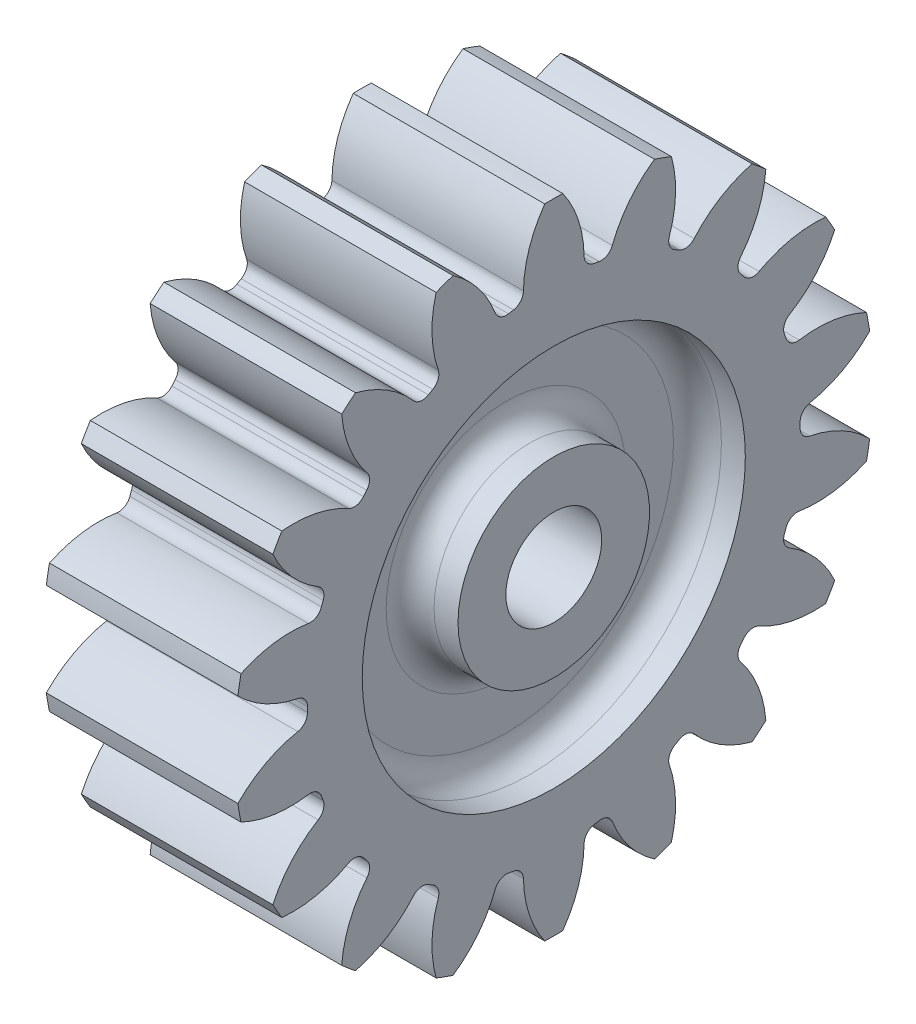
from build123d import *

# Parameters (mm, degrees)
CUT_EXTRUDE1_DEPTH = 3.560815886


with BuildPart() as part:
    # Sketch2 → Revolve1 (revolve)
    with BuildSketch(Plane(origin=(0, 0, 0), x_dir=(1, 0, 0), z_dir=(0, 1, 0)), mode=Mode.PRIVATE) as revolve1_sk:
        with BuildLine():
            Line((-0.5, 0.5), (-0.5, 0.25))
            Line((-0.5, 0.25), (0.5, 0.25))
            Line((0.5, 0.25), (0.5, 0.5))
            Line((0.5, 0.5), (0.375, 0.5))
            ThreePointArc((0.375, 0.5), (0.286611652, 0.536611652), (0.25, 0.625))
            Line((0.25, 0.625), (0.25, 0.875))
            ThreePointArc((0.25, 0.875), (0.286611652, 0.963388348), (0.375, 1))
            Line((0.375, 1), (0.5, 1))
            Line((0.5, 1), (0.5, 1.667))
            Line((0.5, 1.667), (-0.5, 1.667))
            Line((-0.5, 1.667), (-0.5, 1))
            Line((-0.5, 1), (-0.375, 1))
            ThreePointArc((-0.375, 1), (-0.286611652, 0.963388348), (-0.25, 0.875))
            Line((-0.25, 0.875), (-0.25, 0.625))
            ThreePointArc((-0.25, 0.625), (-0.286611652, 0.536611652), (-0.375, 0.5))
            Line((-0.375, 0.5), (-0.5, 0.5))
        make_face()
    revolve(revolve1_sk.sketch.rotate(Axis((-2.928512328, 0, 0), (1, 0, 0)), 180), axis=Axis((-2.928512328, 0, 0), (1, 0, 0)))

    # Sketch3 → Cut-Extrude1 (cut, through all)
    with BuildSketch(Plane(origin=(0.5, 0, 0), x_dir=(0, 0, -1), z_dir=(1, 0, 0))):
        with BuildLine():
            ThreePointArc((-0.132038984, 1.494177268), (-0.096451178, 1.583681212), (-0.047, 1.666337301))
            ThreePointArc((-0.047, 1.666337301), (-0.289471512, 1.641674524), (-0.525755369, 1.581919812))
            ThreePointArc((-0.525755369, 1.581919812), (-0.451016415, 1.521161794), (-0.386962665, 1.449227345))
            ThreePointArc((-0.386962665, 1.449227345), (-0.260472267, 1.47721163), (-0.132038984, 1.494177268))
        make_face()
        with BuildLine():
            ThreePointArc((-0.158403009, 1.328746492), (-0.15102288, 1.412386502), (-0.132038984, 1.494177268))
            ThreePointArc((-0.132038984, 1.494177268), (-0.260472267, 1.47721163), (-0.386962665, 1.449227345))
            ThreePointArc((-0.386962665, 1.449227345), (-0.341149548, 1.378862041), (-0.305607927, 1.302790293))
            ThreePointArc((-0.305607927, 1.302790293), (-0.277975364, 1.270913104), (-0.236343208, 1.26409568))
            ThreePointArc((-0.236343208, 1.26409568), (-0.223311556, 1.26646277), (-0.210256217, 1.26869552))
            ThreePointArc((-0.210256217, 1.26869552), (-0.173466484, 1.289340839), (-0.158403009, 1.328746492))
        make_face()
        with BuildLine():
            ThreePointArc((-0.635114782, 1.35890736), (-0.632285335, 1.455185303), (-0.614086476, 1.549769919))
            ThreePointArc((-0.614086476, 1.549769919), (-0.8335, 1.443664348), (-1.035096882, 1.306699447))
            ThreePointArc((-1.035096882, 1.306699447), (-0.944084772, 1.275167814), (-0.859290905, 1.229479215))
            ThreePointArc((-0.859290905, 1.229479215), (-0.75, 1.299038106), (-0.635114782, 1.35890736))
        make_face()
        with BuildLine():
            ThreePointArc((-0.603308204, 1.194436253), (-0.624979719, 1.275556307), (-0.635114782, 1.35890736))
            ThreePointArc((-0.635114782, 1.35890736), (-0.75, 1.299038106), (-0.859290905, 1.229479215))
            ThreePointArc((-0.859290905, 1.229479215), (-0.792174306, 1.179026467), (-0.732758036, 1.119698358))
            ThreePointArc((-0.732758036, 1.119698358), (-0.69588928, 1.099194492), (-0.654436154, 1.107027245))
            ThreePointArc((-0.654436154, 1.107027245), (-0.643, 1.113708669), (-0.63149564, 1.120271957))
            ThreePointArc((-0.63149564, 1.120271957), (-0.603985713, 1.152255041), (-0.603308204, 1.194436253))
        make_face()
        with BuildLine():
            ThreePointArc((-1.061586364, 1.05973317), (-1.09185655, 1.15117257), (-1.107105059, 1.246277412))
            ThreePointArc((-1.107105059, 1.246277412), (-1.276996087, 1.071526945), (-1.419590434, 0.873871844))
            ThreePointArc((-1.419590434, 0.873871844), (-1.323282572, 0.875369776), (-1.22797598, 0.861437748))
            ThreePointArc((-1.22797598, 0.861437748), (-1.149066665, 0.964181415), (-1.061586364, 1.05973317))
        make_face()
        with BuildLine():
            ThreePointArc((-0.975445526, 0.916059375), (-1.023554781, 0.984875196), (-1.061586364, 1.05973317))
            ThreePointArc((-1.061586364, 1.05973317), (-1.149066665, 0.964181415), (-1.22797598, 0.861437748))
            ThreePointArc((-1.22797598, 0.861437748), (-1.147651151, 0.836982901), (-1.071526712, 0.801554276))
            ThreePointArc((-1.071526712, 0.801554276), (-1.029868679, 0.794896801), (-0.993594441, 0.816434986))
            ThreePointArc((-0.993594441, 0.816434986), (-0.985133154, 0.826624866), (-0.976567368, 0.836727062))
            ThreePointArc((-0.976567368, 0.836727062), (-0.961655352, 0.876190279), (-0.975445526, 0.916059375))
        make_face()
        with BuildLine():
            ThreePointArc((-1.360014963, 0.63273952), (-1.41973375, 0.708311436), (-1.466590434, 0.792465456))
            ThreePointArc((-1.466590434, 0.792465456), (-1.566467599, 0.570147579), (-1.632860429, 0.3356424))
            ThreePointArc((-1.632860429, 0.3356424), (-1.542872965, 0.369989224), (-1.448549029, 0.389494174))
            ThreePointArc((-1.448549029, 0.389494174), (-1.409538931, 0.513030215), (-1.360014963, 0.63273952))
        make_face()
        with BuildLine():
            ThreePointArc((-1.229929722, 0.527192216), (-1.298674031, 0.575403601), (-1.360014963, 0.63273952))
            ThreePointArc((-1.360014963, 0.63273952), (-1.409538931, 0.513030215), (-1.448549029, 0.389494174))
            ThreePointArc((-1.448549029, 0.389494174), (-1.36470433, 0.393986845), (-1.281053453, 0.386730918))
            ThreePointArc((-1.281053453, 0.386730918), (-1.239630716, 0.394722825), (-1.212910576, 0.427368618))
            ThreePointArc((-1.212910576, 0.427368618), (-1.20844471, 0.439837904), (-1.203850659, 0.452260535))
            ThreePointArc((-1.203850659, 0.452260535), (-1.203335163, 0.494444038), (-1.229929722, 0.527192216))
        make_face()
        with BuildLine():
            ThreePointArc((-1.494405686, 0.129428145), (-1.576370107, 0.180017489), (-1.649183357, 0.243070471))
            ThreePointArc((-1.649183357, 0.243070471), (-1.667, 0), (-1.649183357, -0.243070471))
            ThreePointArc((-1.649183357, -0.243070471), (-1.576370107, -0.180017489), (-1.494405686, -0.129428145))
            ThreePointArc((-1.494405686, -0.129428145), (-1.5, 0), (-1.494405686, 0.129428145))
        make_face()
        with BuildLine():
            ThreePointArc((-1.336066241, 0.074737895), (-1.417154025, 0.096529839), (-1.494405686, 0.129428145))
            ThreePointArc((-1.494405686, 0.129428145), (-1.5, 0), (-1.494405686, -0.129428145))
            ThreePointArc((-1.494405686, -0.129428145), (-1.417154025, -0.096529839), (-1.336066241, -0.074737895))
            ThreePointArc((-1.336066241, -0.074737895), (-1.299874994, -0.053060549), (-1.285931794, -0.013244712))
            ThreePointArc((-1.285931794, -0.013244712), (-1.286, 0), (-1.285931794, 0.013244712))
            ThreePointArc((-1.285931794, 0.013244712), (-1.299874994, 0.053060549), (-1.336066241, 0.074737895))
        make_face()
        with BuildLine():
            ThreePointArc((-1.632860429, -0.3356424), (-1.566467599, -0.570147579), (-1.466590434, -0.792465456))
            ThreePointArc((-1.466590434, -0.792465456), (-1.41973375, -0.708311436), (-1.360014963, -0.63273952))
            ThreePointArc((-1.360014963, -0.63273952), (-1.409538931, -0.513030215), (-1.448549029, -0.389494174))
            ThreePointArc((-1.448549029, -0.389494174), (-1.542872965, -0.369989224), (-1.632860429, -0.3356424))
        make_face()
        with BuildLine():
            ThreePointArc((-1.448549029, -0.389494174), (-1.409538931, -0.513030215), (-1.360014963, -0.63273952))
            ThreePointArc((-1.360014963, -0.63273952), (-1.298674031, -0.575403601), (-1.229929722, -0.527192216))
            ThreePointArc((-1.229929722, -0.527192216), (-1.203335163, -0.494444038), (-1.203850659, -0.452260535))
            ThreePointArc((-1.203850659, -0.452260535), (-1.20844471, -0.439837904), (-1.212910576, -0.427368618))
            ThreePointArc((-1.212910576, -0.427368618), (-1.239630716, -0.394722825), (-1.281053453, -0.386730918))
            ThreePointArc((-1.281053453, -0.386730918), (-1.36470433, -0.393986845), (-1.448549029, -0.389494174))
        make_face()
        with BuildLine():
            ThreePointArc((-1.419590434, -0.873871844), (-1.276996087, -1.071526945), (-1.107105059, -1.246277412))
            ThreePointArc((-1.107105059, -1.246277412), (-1.09185655, -1.15117257), (-1.061586364, -1.05973317))
            ThreePointArc((-1.061586364, -1.05973317), (-1.149066665, -0.964181415), (-1.22797598, -0.861437748))
            ThreePointArc((-1.22797598, -0.861437748), (-1.323282572, -0.875369776), (-1.419590434, -0.873871844))
        make_face()
        with BuildLine():
            ThreePointArc((-1.22797598, -0.861437748), (-1.149066665, -0.964181415), (-1.061586364, -1.05973317))
            ThreePointArc((-1.061586364, -1.05973317), (-1.023554781, -0.984875196), (-0.975445526, -0.916059375))
            ThreePointArc((-0.975445526, -0.916059375), (-0.961655352, -0.876190279), (-0.976567368, -0.836727062))
            ThreePointArc((-0.976567368, -0.836727062), (-0.985133154, -0.826624866), (-0.993594441, -0.816434986))
            ThreePointArc((-0.993594441, -0.816434986), (-1.029868679, -0.794896801), (-1.071526712, -0.801554276))
            ThreePointArc((-1.071526712, -0.801554276), (-1.147651151, -0.836982901), (-1.22797598, -0.861437748))
        make_face()
        with BuildLine():
            ThreePointArc((-1.035096882, -1.306699447), (-0.8335, -1.443664348), (-0.614086476, -1.549769919))
            ThreePointArc((-0.614086476, -1.549769919), (-0.632285335, -1.455185303), (-0.635114782, -1.35890736))
            ThreePointArc((-0.635114782, -1.35890736), (-0.75, -1.299038106), (-0.859290905, -1.229479215))
            ThreePointArc((-0.859290905, -1.229479215), (-0.944084772, -1.275167814), (-1.035096882, -1.306699447))
        make_face()
        with BuildLine():
            ThreePointArc((-0.859290905, -1.229479215), (-0.75, -1.299038106), (-0.635114782, -1.35890736))
            ThreePointArc((-0.635114782, -1.35890736), (-0.624979719, -1.275556307), (-0.603308204, -1.194436253))
            ThreePointArc((-0.603308204, -1.194436253), (-0.603985713, -1.152255041), (-0.63149564, -1.120271957))
            ThreePointArc((-0.63149564, -1.120271957), (-0.643, -1.113708669), (-0.654436154, -1.107027245))
            ThreePointArc((-0.654436154, -1.107027245), (-0.69588928, -1.099194492), (-0.732758036, -1.119698358))
            ThreePointArc((-0.732758036, -1.119698358), (-0.792174306, -1.179026467), (-0.859290905, -1.229479215))
        make_face()
        with BuildLine():
            ThreePointArc((-0.525755369, -1.581919812), (-0.289471512, -1.641674524), (-0.047, -1.666337301))
            ThreePointArc((-0.047, -1.666337301), (-0.096451178, -1.583681212), (-0.132038984, -1.494177268))
            ThreePointArc((-0.132038984, -1.494177268), (-0.260472267, -1.47721163), (-0.386962665, -1.449227345))
            ThreePointArc((-0.386962665, -1.449227345), (-0.451016415, -1.521161794), (-0.525755369, -1.581919812))
        make_face()
        with BuildLine():
            ThreePointArc((-0.386962665, -1.449227345), (-0.260472267, -1.47721163), (-0.132038984, -1.494177268))
            ThreePointArc((-0.132038984, -1.494177268), (-0.15102288, -1.412386502), (-0.158403009, -1.328746492))
            ThreePointArc((-0.158403009, -1.328746492), (-0.173466484, -1.289340839), (-0.210256217, -1.26869552))
            ThreePointArc((-0.210256217, -1.26869552), (-0.223311556, -1.26646277), (-0.236343208, -1.26409568))
            ThreePointArc((-0.236343208, -1.26409568), (-0.277975364, -1.270913104), (-0.305607927, -1.302790293))
            ThreePointArc((-0.305607927, -1.302790293), (-0.341149548, -1.378862041), (-0.386962665, -1.449227345))
        make_face()
        with BuildLine():
            ThreePointArc((0.047, -1.666337301), (0.289471512, -1.641674524), (0.525755369, -1.581919812))
            ThreePointArc((0.525755369, -1.581919812), (0.451016415, -1.521161794), (0.386962665, -1.449227345))
            ThreePointArc((0.386962665, -1.449227345), (0.260472267, -1.47721163), (0.132038984, -1.494177268))
            ThreePointArc((0.132038984, -1.494177268), (0.096451178, -1.583681212), (0.047, -1.666337301))
        make_face()
        with BuildLine():
            ThreePointArc((0.132038984, -1.494177268), (0.260472267, -1.47721163), (0.386962665, -1.449227345))
            ThreePointArc((0.386962665, -1.449227345), (0.341149548, -1.378862041), (0.305607927, -1.302790293))
            ThreePointArc((0.305607927, -1.302790293), (0.277975364, -1.270913104), (0.236343208, -1.26409568))
            ThreePointArc((0.236343208, -1.26409568), (0.223311556, -1.26646277), (0.210256217, -1.26869552))
            ThreePointArc((0.210256217, -1.26869552), (0.173466484, -1.289340839), (0.158403009, -1.328746492))
            ThreePointArc((0.158403009, -1.328746492), (0.15102288, -1.412386502), (0.132038984, -1.494177268))
        make_face()
        with BuildLine():
            ThreePointArc((0.614086476, -1.549769919), (0.8335, -1.443664348), (1.035096882, -1.306699447))
            ThreePointArc((1.035096882, -1.306699447), (0.944084772, -1.275167814), (0.859290905, -1.229479215))
            ThreePointArc((0.859290905, -1.229479215), (0.75, -1.299038106), (0.635114782, -1.35890736))
            ThreePointArc((0.635114782, -1.35890736), (0.632285335, -1.455185303), (0.614086476, -1.549769919))
        make_face()
        with BuildLine():
            ThreePointArc((0.635114782, -1.35890736), (0.75, -1.299038106), (0.859290905, -1.229479215))
            ThreePointArc((0.859290905, -1.229479215), (0.792174306, -1.179026467), (0.732758036, -1.119698358))
            ThreePointArc((0.732758036, -1.119698358), (0.69588928, -1.099194492), (0.654436154, -1.107027245))
            ThreePointArc((0.654436154, -1.107027245), (0.643, -1.113708669), (0.63149564, -1.120271957))
            ThreePointArc((0.63149564, -1.120271957), (0.603985713, -1.152255041), (0.603308204, -1.194436253))
            ThreePointArc((0.603308204, -1.194436253), (0.624979719, -1.275556307), (0.635114782, -1.35890736))
        make_face()
        with BuildLine():
            ThreePointArc((1.107105059, -1.246277412), (1.276996087, -1.071526945), (1.419590434, -0.873871844))
            ThreePointArc((1.419590434, -0.873871844), (1.323282572, -0.875369776), (1.22797598, -0.861437748))
            ThreePointArc((1.22797598, -0.861437748), (1.149066665, -0.964181415), (1.061586364, -1.05973317))
            ThreePointArc((1.061586364, -1.05973317), (1.09185655, -1.15117257), (1.107105059, -1.246277412))
        make_face()
        with BuildLine():
            ThreePointArc((1.061586364, -1.05973317), (1.149066665, -0.964181415), (1.22797598, -0.861437748))
            ThreePointArc((1.22797598, -0.861437748), (1.147651151, -0.836982901), (1.071526712, -0.801554276))
            ThreePointArc((1.071526712, -0.801554276), (1.029868679, -0.794896801), (0.993594441, -0.816434986))
            ThreePointArc((0.993594441, -0.816434986), (0.985133154, -0.826624866), (0.976567368, -0.836727062))
            ThreePointArc((0.976567368, -0.836727062), (0.961655352, -0.876190279), (0.975445526, -0.916059375))
            ThreePointArc((0.975445526, -0.916059375), (1.023554781, -0.984875196), (1.061586364, -1.05973317))
        make_face()
        with BuildLine():
            ThreePointArc((1.466590434, -0.792465456), (1.566467599, -0.570147579), (1.632860429, -0.3356424))
            ThreePointArc((1.632860429, -0.3356424), (1.542872965, -0.369989224), (1.448549029, -0.389494174))
            ThreePointArc((1.448549029, -0.389494174), (1.409538931, -0.513030215), (1.360014963, -0.63273952))
            ThreePointArc((1.360014963, -0.63273952), (1.41973375, -0.708311436), (1.466590434, -0.792465456))
        make_face()
        with BuildLine():
            ThreePointArc((1.360014963, -0.63273952), (1.409538931, -0.513030215), (1.448549029, -0.389494174))
            ThreePointArc((1.448549029, -0.389494174), (1.36470433, -0.393986845), (1.281053453, -0.386730918))
            ThreePointArc((1.281053453, -0.386730918), (1.239630716, -0.394722825), (1.212910576, -0.427368618))
            ThreePointArc((1.212910576, -0.427368618), (1.20844471, -0.439837904), (1.203850659, -0.452260535))
            ThreePointArc((1.203850659, -0.452260535), (1.203335163, -0.494444038), (1.229929722, -0.527192216))
            ThreePointArc((1.229929722, -0.527192216), (1.298674031, -0.575403601), (1.360014963, -0.63273952))
        make_face()
        with BuildLine():
            ThreePointArc((1.649183357, -0.243070471), (1.662539873, -0.121861281), (1.667, 0))
            ThreePointArc((1.667, 0), (1.662539873, 0.121861281), (1.649183357, 0.243070471))
            ThreePointArc((1.649183357, 0.243070471), (1.576370107, 0.180017489), (1.494405686, 0.129428145))
            ThreePointArc((1.494405686, 0.129428145), (1.498600769, 0.064774495), (1.5, 0))
            ThreePointArc((1.5, 0), (1.498600769, -0.064774495), (1.494405686, -0.129428145))
            ThreePointArc((1.494405686, -0.129428145), (1.576370107, -0.180017489), (1.649183357, -0.243070471))
        make_face()
        with BuildLine():
            ThreePointArc((1.5, 0), (1.498600769, 0.064774495), (1.494405686, 0.129428145))
            ThreePointArc((1.494405686, 0.129428145), (1.417154025, 0.096529839), (1.336066241, 0.074737895))
            ThreePointArc((1.336066241, 0.074737895), (1.299874994, 0.053060549), (1.285931794, 0.013244712))
            ThreePointArc((1.285931794, 0.013244712), (1.285982948, 0.006622444), (1.286, 0))
            ThreePointArc((1.286, 0), (1.285982948, -0.006622444), (1.285931794, -0.013244712))
            ThreePointArc((1.285931794, -0.013244712), (1.299874994, -0.053060549), (1.336066241, -0.074737895))
            ThreePointArc((1.336066241, -0.074737895), (1.417154025, -0.096529839), (1.494405686, -0.129428145))
            ThreePointArc((1.494405686, -0.129428145), (1.498600769, -0.064774495), (1.5, 0))
        make_face()
        with BuildLine():
            ThreePointArc((1.448549029, 0.389494174), (1.542872965, 0.369989224), (1.632860429, 0.3356424))
            ThreePointArc((1.632860429, 0.3356424), (1.566467599, 0.570147579), (1.466590434, 0.792465456))
            ThreePointArc((1.466590434, 0.792465456), (1.41973375, 0.708311436), (1.360014963, 0.63273952))
            ThreePointArc((1.360014963, 0.63273952), (1.409538931, 0.513030215), (1.448549029, 0.389494174))
        make_face()
        with BuildLine():
            ThreePointArc((1.281053453, 0.386730918), (1.36470433, 0.393986845), (1.448549029, 0.389494174))
            ThreePointArc((1.448549029, 0.389494174), (1.409538931, 0.513030215), (1.360014963, 0.63273952))
            ThreePointArc((1.360014963, 0.63273952), (1.298674031, 0.575403601), (1.229929722, 0.527192216))
            ThreePointArc((1.229929722, 0.527192216), (1.203335163, 0.494444038), (1.203850659, 0.452260535))
            ThreePointArc((1.203850659, 0.452260535), (1.20844471, 0.439837904), (1.212910576, 0.427368618))
            ThreePointArc((1.212910576, 0.427368618), (1.239630716, 0.394722825), (1.281053453, 0.386730918))
        make_face()
        with BuildLine():
            ThreePointArc((1.22797598, 0.861437748), (1.323282572, 0.875369776), (1.419590434, 0.873871844))
            ThreePointArc((1.419590434, 0.873871844), (1.276996087, 1.071526945), (1.107105059, 1.246277412))
            ThreePointArc((1.107105059, 1.246277412), (1.09185655, 1.15117257), (1.061586364, 1.05973317))
            ThreePointArc((1.061586364, 1.05973317), (1.149066665, 0.964181415), (1.22797598, 0.861437748))
        make_face()
        with BuildLine():
            ThreePointArc((1.071526712, 0.801554276), (1.147651151, 0.836982901), (1.22797598, 0.861437748))
            ThreePointArc((1.22797598, 0.861437748), (1.149066665, 0.964181415), (1.061586364, 1.05973317))
            ThreePointArc((1.061586364, 1.05973317), (1.023554781, 0.984875196), (0.975445526, 0.916059375))
            ThreePointArc((0.975445526, 0.916059375), (0.961655352, 0.876190279), (0.976567368, 0.836727062))
            ThreePointArc((0.976567368, 0.836727062), (0.985133154, 0.826624866), (0.993594441, 0.816434986))
            ThreePointArc((0.993594441, 0.816434986), (1.029868679, 0.794896801), (1.071526712, 0.801554276))
        make_face()
        with BuildLine():
            ThreePointArc((0.859290905, 1.229479215), (0.944084772, 1.275167814), (1.035096882, 1.306699447))
            ThreePointArc((1.035096882, 1.306699447), (0.8335, 1.443664348), (0.614086476, 1.549769919))
            ThreePointArc((0.614086476, 1.549769919), (0.632285335, 1.455185303), (0.635114782, 1.35890736))
            ThreePointArc((0.635114782, 1.35890736), (0.75, 1.299038106), (0.859290905, 1.229479215))
        make_face()
        with BuildLine():
            ThreePointArc((0.732758036, 1.119698358), (0.792174306, 1.179026467), (0.859290905, 1.229479215))
            ThreePointArc((0.859290905, 1.229479215), (0.75, 1.299038106), (0.635114782, 1.35890736))
            ThreePointArc((0.635114782, 1.35890736), (0.624979719, 1.275556307), (0.603308204, 1.194436253))
            ThreePointArc((0.603308204, 1.194436253), (0.603985713, 1.152255041), (0.63149564, 1.120271957))
            ThreePointArc((0.63149564, 1.120271957), (0.643, 1.113708669), (0.654436154, 1.107027245))
            ThreePointArc((0.654436154, 1.107027245), (0.69588928, 1.099194492), (0.732758036, 1.119698358))
        make_face()
        with BuildLine():
            ThreePointArc((0.386962665, 1.449227345), (0.451016415, 1.521161794), (0.525755369, 1.581919812))
            ThreePointArc((0.525755369, 1.581919812), (0.289471512, 1.641674524), (0.047, 1.666337301))
            ThreePointArc((0.047, 1.666337301), (0.096451178, 1.583681212), (0.132038984, 1.494177268))
            ThreePointArc((0.132038984, 1.494177268), (0.260472267, 1.47721163), (0.386962665, 1.449227345))
        make_face()
        with BuildLine():
            ThreePointArc((0.305607927, 1.302790293), (0.341149548, 1.378862041), (0.386962665, 1.449227345))
            ThreePointArc((0.386962665, 1.449227345), (0.260472267, 1.47721163), (0.132038984, 1.494177268))
            ThreePointArc((0.132038984, 1.494177268), (0.15102288, 1.412386502), (0.158403009, 1.328746492))
            ThreePointArc((0.158403009, 1.328746492), (0.173466484, 1.289340839), (0.210256217, 1.26869552))
            ThreePointArc((0.210256217, 1.26869552), (0.223311556, 1.26646277), (0.236343208, 1.26409568))
            ThreePointArc((0.236343208, 1.26409568), (0.277975364, 1.270913104), (0.305607927, 1.302790293))
        make_face()
    extrude(amount=-CUT_EXTRUDE1_DEPTH, mode=Mode.SUBTRACT)


solid = part.part
